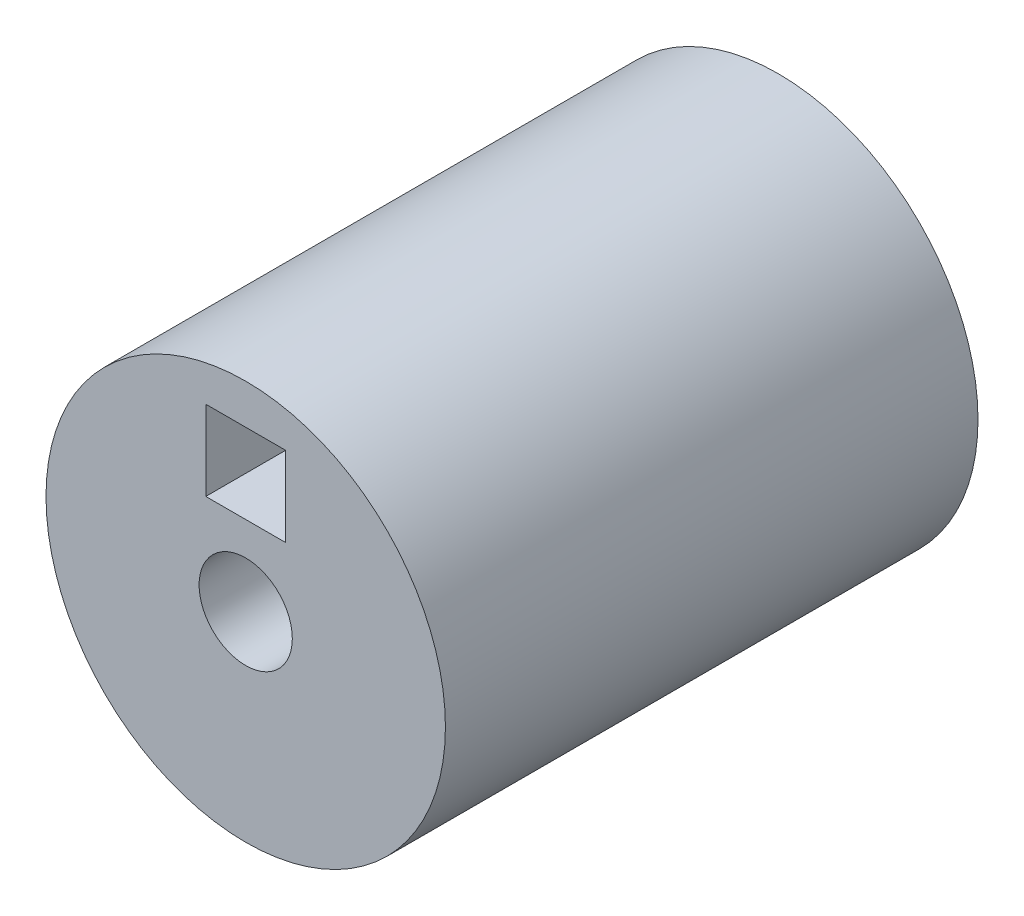
from build123d import *

# Parameters (mm, degrees)
SKETCH1_R           = 7.5
SKETCH1_R_2         = 1.75
BOSS_EXTRUDE1_DEPTH = 20
SKETCH2_W           = 3
SKETCH2_H           = 3
CUT_EXTRUDE1_DEPTH  = 8
CUT_EXTRUDE2_DEPTH  = 8


with BuildPart() as part:
    # Sketch1 → Boss-Extrude1 (new body)
    with BuildSketch(Plane.XY):
        Circle(SKETCH1_R)
        Circle(SKETCH1_R_2, mode=Mode.SUBTRACT)
    extrude(amount=BOSS_EXTRUDE1_DEPTH)

    # Sketch2 → Cut-Extrude1 (cut)
    with BuildSketch(Plane.XY.offset(20)):
        with Locations((0, 4.5)):
            Rectangle(SKETCH2_W, SKETCH2_H)
    extrude(amount=-CUT_EXTRUDE1_DEPTH, mode=Mode.SUBTRACT)

    # Sketch3 → Cut-Extrude2 (cut)
    with BuildSketch(Plane(origin=(0, 0, 0), x_dir=(-1, 0, 0), z_dir=(0, 0, -1))):
        Polygon((-0.499533791, 3.31669504), (0.427517192, 6.169864589), (3.280686741, 5.242813606), (2.353635758, 2.389644057), align=None)
    extrude(amount=-CUT_EXTRUDE2_DEPTH, mode=Mode.SUBTRACT)


solid = part.part
